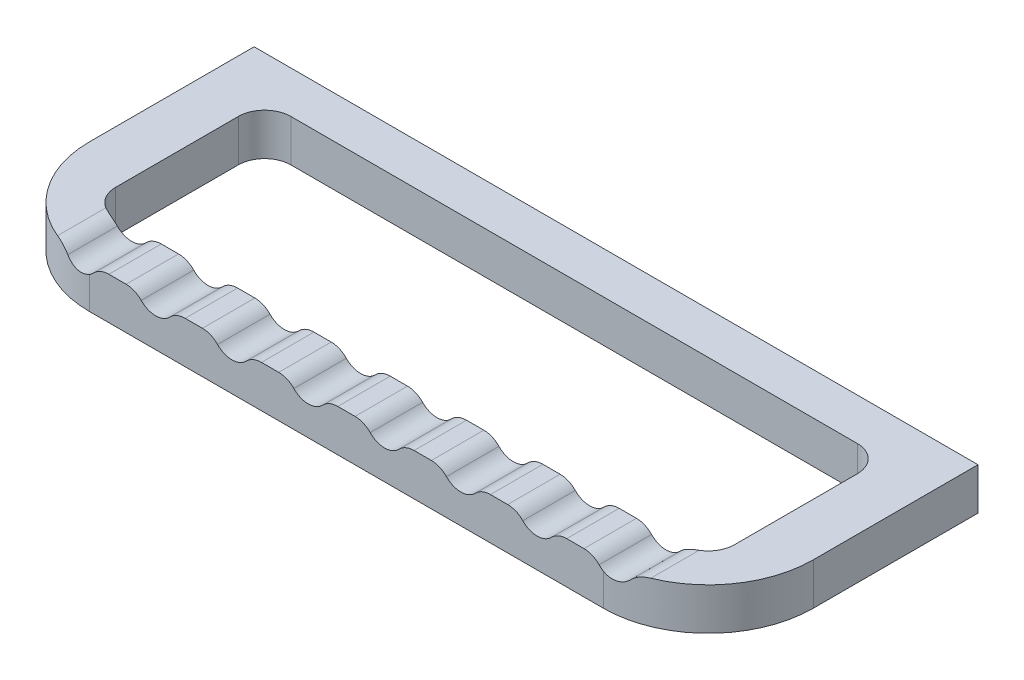
from build123d import *

# Parameters (mm, degrees)
BOSS_EXTRUDE1_DEPTH = 6.35
FILLET1_R           = 2.54
SKETCH1_3_W         = 6.35
SKETCH1_3_H         = 5.08
BOSS_EXTRUDE2_DEPTH = 26.289
SKETCH2_R           = 1.9939
CUT_EXTRUDE1_DEPTH  = 19.05
SKETCH3_W           = 5.08
SKETCH3_H           = 5.08
BOSS_EXTRUDE3_DEPTH = 74.91984
FILLET2_R           = 3.175
FILLET3_R           = 12.7


with BuildPart() as part:
    # Sketch1 → Boss-Extrude1 (new body)
    with BuildSketch(Plane.XY):
        with BuildLine():
            Line((-43.80992, 2.54), (-43.80992, -2.54))
            Line((-43.80992, -2.54), (43.80992, -2.54))
            Line((43.80992, -2.54), (43.80992, 2.54))
            Line((43.80992, 2.54), (34.572886058, 2.54))
            ThreePointArc((34.572886058, 2.54), (32.329618798, 1.016), (30.086351538, 2.54))
            Line((30.086351538, 2.54), (25.335852116, 2.54))
            ThreePointArc((25.335852116, 2.54), (23.092584856, 1.016), (20.849317595, 2.54))
            Line((20.849317595, 2.54), (16.098818173, 2.54))
            ThreePointArc((16.098818173, 2.54), (13.855550913, 1.016), (11.612283653, 2.54))
            Line((11.612283653, 2.54), (6.861784231, 2.54))
            ThreePointArc((6.861784231, 2.54), (4.618516971, 1.016), (2.375249711, 2.54))
            Line((2.375249711, 2.54), (-2.375249711, 2.54))
            ThreePointArc((-2.375249711, 2.54), (-4.618516971, 1.016), (-6.861784231, 2.54))
            Line((-6.861784231, 2.54), (-11.612283653, 2.54))
            ThreePointArc((-11.612283653, 2.54), (-13.855550913, 1.016), (-16.098818173, 2.54))
            Line((-16.098818173, 2.54), (-20.849317595, 2.54))
            ThreePointArc((-20.849317595, 2.54), (-23.092584856, 1.016), (-25.335852116, 2.54))
            Line((-25.335852116, 2.54), (-30.086351538, 2.54))
            ThreePointArc((-30.086351538, 2.54), (-32.329618798, 1.016), (-34.572886058, 2.54))
            Line((-34.572886058, 2.54), (-43.80992, 2.54))
        make_face()
    extrude(amount=BOSS_EXTRUDE1_DEPTH)

    # Fillet1
    fillet1_edges = [part.edges().sort_by_distance(p)[0] for p in [
        (-34.572886058, 2.54, 3.175),
        (-30.086351538, 2.54, 3.175),
        (-25.335852116, 2.54, 3.175),
        (-20.849317595, 2.54, 3.175),
        (-16.098818173, 2.54, 3.175),
        (-11.612283653, 2.54, 3.175),
        (-6.861784231, 2.54, 3.175),
        (-2.375249711, 2.54, 3.175),
        (2.375249711, 2.54, 3.175),
        (6.861784231, 2.54, 3.175),
        (11.612283653, 2.54, 3.175),
        (16.098818173, 2.54, 3.175),
        (20.849317595, 2.54, 3.175),
        (25.335852116, 2.54, 3.175),
        (30.086351538, 2.54, 3.175),
        (34.572886058, 2.54, 3.175),
    ]]
    fillet(fillet1_edges, radius=FILLET1_R)

    # Sketch1<3> → Boss-Extrude2 (add)
    with BuildSketch(Plane.XY):
        with Locations((-40.63492, 0)):
            Rectangle(SKETCH1_3_W, SKETCH1_3_H)
        Polygon((37.45992, 0), (37.45992, -2.54), (43.80992, -2.54), (43.80992, 2.54), (37.45992, 2.54), align=None)
    extrude(amount=-BOSS_EXTRUDE2_DEPTH)

    # Sketch2 → Cut-Extrude1 (cut)
    with BuildSketch(Plane(origin=(0, 0, -26.289), x_dir=(-1, 0, 0), z_dir=(0, 0, -1))):
        with Locations((-40.63492, 0)):
            Circle(SKETCH2_R)
        with Locations((40.63492, 0)):
            Circle(SKETCH2_R)
    extrude(amount=-CUT_EXTRUDE1_DEPTH, mode=Mode.SUBTRACT)

    # Sketch3 → Boss-Extrude3 (add)
    with BuildSketch(Plane.ZY.offset(-37.45992)):
        with Locations((-23.749, 0)):
            Rectangle(SKETCH3_W, SKETCH3_H)
    extrude(amount=BOSS_EXTRUDE3_DEPTH)

    # Fillet2
    fillet2_edges = [part.edges().sort_by_distance(p)[0] for p in [
        (37.45992, 0, -21.209),
        (-37.45992, 0, -21.209),
        (-37.45992, 0, 0),
        (37.45992, 0, 0),
    ]]
    fillet(fillet2_edges, radius=FILLET2_R)

    # Fillet3
    fillet3_edges = [part.edges().sort_by_distance(p)[0] for p in [
        (-43.80992, 0, 6.35),
        (43.80992, 0, 6.35),
    ]]
    fillet(fillet3_edges, radius=FILLET3_R)


solid = part.part
